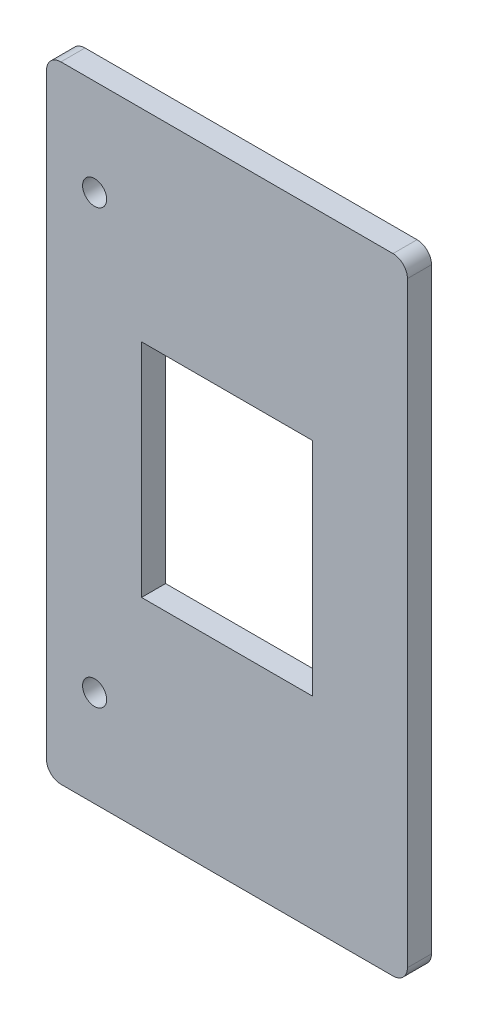
from build123d import *

# Parameters (mm, degrees)
SKETCH_1_W          = 75
SKETCH_1_H          = 130
EXTRUDE_1_DEPTH     = 5
SKETCH_2_W          = 35.5
SKETCH_2_H          = 46
SKETCH_2_R          = 2.5
CUT_EXTRUDE_1_DEPTH = 10
FILLET_1_R          = 3


with BuildPart() as part:
    # 草图1 → 凸台-拉伸1 (new body)
    with BuildSketch(Plane.XY):
        Rectangle(SKETCH_1_W, SKETCH_1_H)
    extrude(amount=EXTRUDE_1_DEPTH)

    # 草图2 → 切除-拉伸1 (cut)
    with BuildSketch(Plane.XY.offset(5)):
        Rectangle(SKETCH_2_W, SKETCH_2_H)
        with Locations((-27.5, -45)):
            Circle(SKETCH_2_R)
        with Locations((-27.5, 45)):
            Circle(SKETCH_2_R)
    extrude(amount=-CUT_EXTRUDE_1_DEPTH, mode=Mode.SUBTRACT)

    # 圆角1
    fillet_1_edges = [part.edges().sort_by_distance(p)[0] for p in [
        (37.5, -65, 2.5),
        (-37.5, -65, 2.5),
        (-37.5, 65, 2.5),
        (37.5, 65, 2.5),
    ]]
    fillet(fillet_1_edges, radius=FILLET_1_R)


solid = part.part
